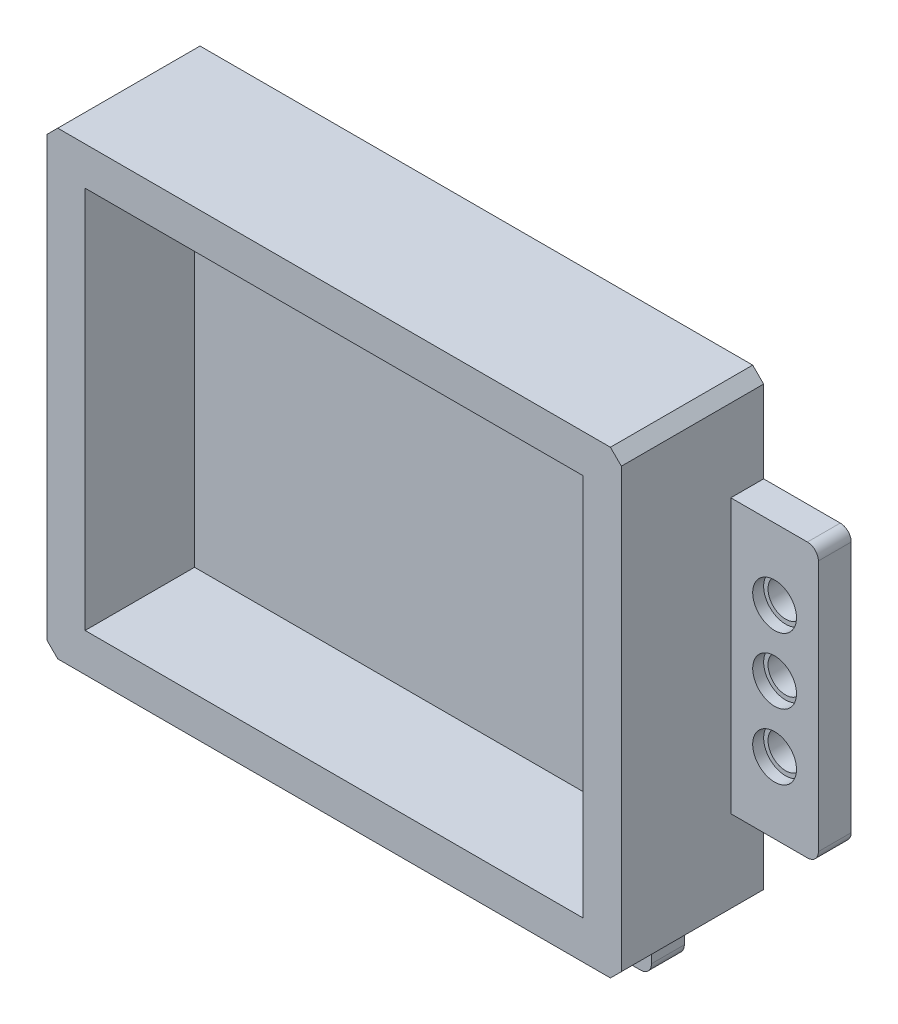
from build123d import *

# Parameters (mm, degrees)
CROQUIS1_W              = 52.5
CROQUIS1_H              = 42
CROQUIS1_W_2            = 45.5
CROQUIS1_H_2            = 35
SALIENTE_EXTRUIR1_DEPTH = 10
CROQUIS3_W              = 52.5
CROQUIS3_H              = 42
SALIENTE_EXTRUIR2_DEPTH = 3
CROQUIS4_W              = 38
CROQUIS4_H              = 3
SALIENTE_EXTRUIR3_DEPTH = 8
CROQUIS5_R              = 2
CORTAR_EXTRUIR1_DEPTH   = 1
CROQUIS6_R              = 1.6
CORTAR_EXTRUIR2_DEPTH   = 4
CROQUIS7_W              = 3
CROQUIS7_H              = 25
SALIENTE_EXTRUIR4_DEPTH = 8
CROQUIS8_R              = 2
CORTAR_EXTRUIR3_DEPTH   = 1
CROQUIS9_R              = 1.6
CORTAR_EXTRUIR4_DEPTH   = 3
CHAFL_N1_SIZE           = 1
REDONDEO2_R             = 1


with BuildPart() as part:
    # Croquis1 → Saliente-Extruir1 (new body)
    with BuildSketch(Plane.XY):
        Rectangle(CROQUIS1_W, CROQUIS1_H)
        Rectangle(CROQUIS1_W_2, CROQUIS1_H_2, mode=Mode.SUBTRACT)
    extrude(amount=SALIENTE_EXTRUIR1_DEPTH)

    # Croquis3 → Saliente-Extruir2 (add)
    with BuildSketch(Plane.XY):
        Rectangle(CROQUIS3_W, CROQUIS3_H)
    extrude(amount=-SALIENTE_EXTRUIR2_DEPTH)

    # Croquis4 → Saliente-Extruir3 (add)
    with BuildSketch(Plane.XZ.offset(21)):
        with Locations((0, -1.5)):
            Rectangle(CROQUIS4_W, CROQUIS4_H)
    extrude(amount=SALIENTE_EXTRUIR3_DEPTH)

    # Croquis5 → Cortar-Extruir1 (cut)
    with BuildSketch(Plane.XY):
        with Locations((-12, -25)):
            Circle(CROQUIS5_R)
        with Locations((-6, -25)):
            Circle(CROQUIS5_R)
        with Locations((0, -25)):
            Circle(CROQUIS5_R)
        with Locations((6, -25)):
            Circle(CROQUIS5_R)
        with Locations((12, -25)):
            Circle(CROQUIS5_R)
    extrude(amount=-CORTAR_EXTRUIR1_DEPTH, mode=Mode.SUBTRACT)

    # Croquis6 → Cortar-Extruir2 (cut)
    with BuildSketch(Plane.XY.offset(-1)):
        with Locations((-12, -25)):
            Circle(CROQUIS6_R)
        with Locations((-6, -25)):
            Circle(CROQUIS6_R)
        with Locations((0, -25)):
            Circle(CROQUIS6_R)
        with Locations((6, -25)):
            Circle(CROQUIS6_R)
        with Locations((12, -25)):
            Circle(CROQUIS6_R)
    extrude(amount=-CORTAR_EXTRUIR2_DEPTH, mode=Mode.SUBTRACT)

    # Croquis7 → Saliente-Extruir4 (add)
    with BuildSketch(Plane(origin=(26.25, 0, 0), x_dir=(0, 0, -1), z_dir=(1, 0, 0))):
        with Locations((1.5, 0)):
            Rectangle(CROQUIS7_W, CROQUIS7_H)
    extrude(amount=SALIENTE_EXTRUIR4_DEPTH)

    # Croquis8 → Cortar-Extruir3 (cut)
    with BuildSketch(Plane.XY):
        with Locations((30.25, 6)):
            Circle(CROQUIS8_R)
        with Locations((30.25, 0)):
            Circle(CROQUIS8_R)
        with Locations((30.25, -6)):
            Circle(CROQUIS8_R)
    extrude(amount=-CORTAR_EXTRUIR3_DEPTH, mode=Mode.SUBTRACT)

    # Croquis9 → Cortar-Extruir4 (cut)
    with BuildSketch(Plane(origin=(0, 0, -3), x_dir=(-1, 0, 0), z_dir=(0, 0, -1))):
        with Locations((-30.25, 6)):
            Circle(CROQUIS9_R)
        with Locations((-30.25, 0)):
            Circle(CROQUIS9_R)
        with Locations((-30.25, -6)):
            Circle(CROQUIS9_R)
    extrude(amount=-CORTAR_EXTRUIR4_DEPTH, mode=Mode.SUBTRACT)

    # Chaflán1
    chafl_n1_edges = [part.edges().sort_by_distance(p)[0] for p in [
        (26.25, -21, 3.5),
        (-26.25, -21, 3.5),
        (-26.25, 21, 3.5),
        (26.25, 21, 3.5),
    ]]
    chamfer(chafl_n1_edges, length=CHAFL_N1_SIZE)

    # Redondeo2
    redondeo2_edges = [part.edges().sort_by_distance(p)[0] for p in [
        (34.25, 12.5, -1.5),
        (34.25, -12.5, -1.5),
        (19, -29, -1.5),
        (-19, -29, -1.5),
    ]]
    fillet(redondeo2_edges, radius=REDONDEO2_R)


solid = part.part
